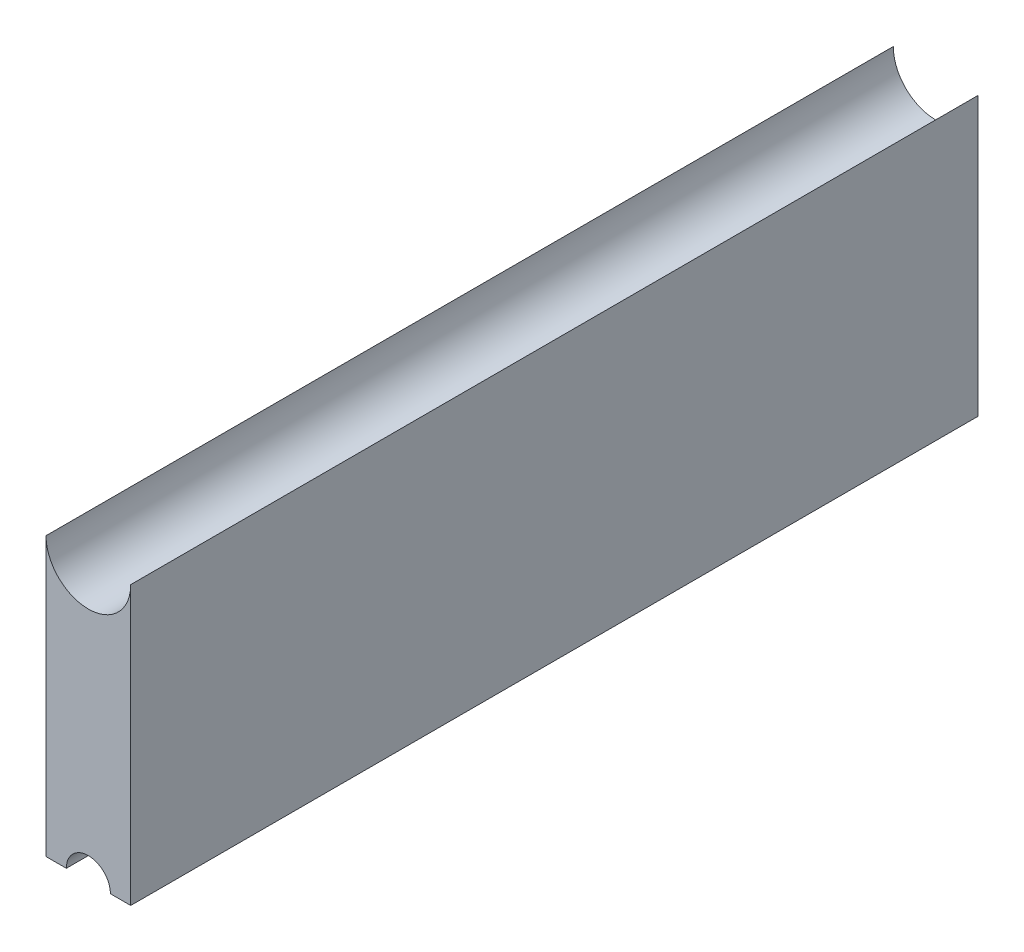
from build123d import *

# Parameters (mm, degrees)
BOSS_EXTRUDE4_DEPTH = 63.5


with BuildPart() as part:
    # Sketch1 → Boss-Extrude4 (new body)
    with BuildSketch(Plane.XY):
        with BuildLine():
            Line((-5.207, -29.21), (-5.207, -8.382))
            ThreePointArc((-5.207, -8.382), (-8.382, -11.557), (-11.557, -8.382))
            Line((-11.557, -8.382), (-11.557, -29.21))
            Line((-11.557, -29.21), (-10.033, -29.21))
            ThreePointArc((-10.033, -29.21), (-8.382, -27.559), (-6.731, -29.21))
            Line((-6.731, -29.21), (-5.207, -29.21))
        make_face()
    extrude(amount=BOSS_EXTRUDE4_DEPTH)


solid = part.part
